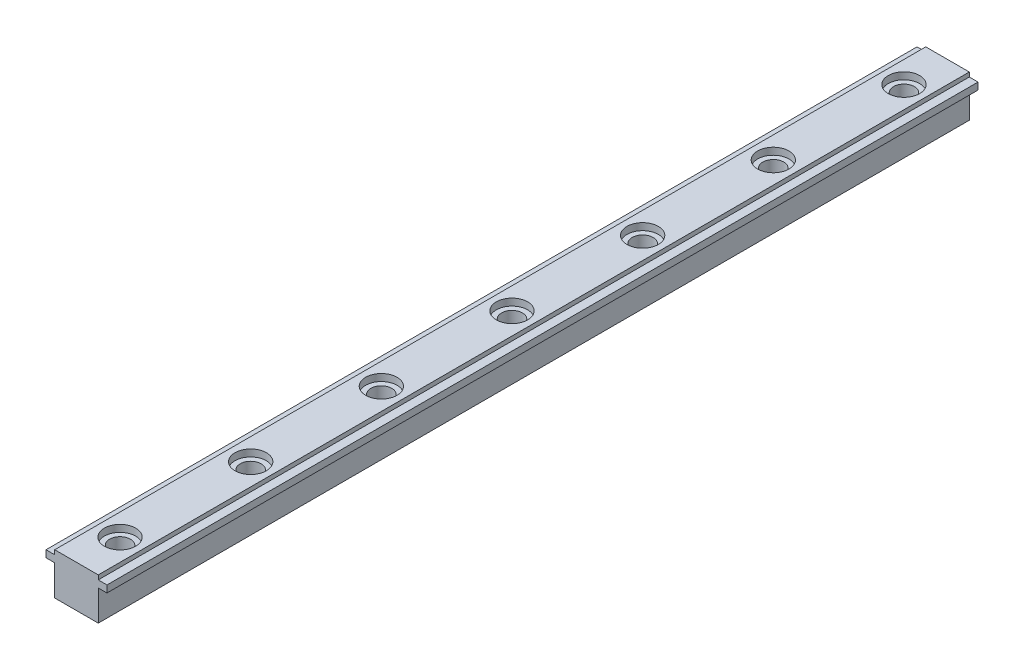
from build123d import *

# Parameters (mm, degrees)
SKETCH_1_W             = 1
SKETCH_1_H             = 0.8
EXTRUDE_1_DEPTH        = 40
CUT_EXTRUDE_1_DEPTH    = 55
SKETCH_3_R             = 1.8
CUT_EXTRUDE_2_DEPTH    = 0.8
MOVE_FACE_2_BY         = 60
PATTERN_LINEAR_1_COUNT = 5
PATTERN_LINEAR_1_PITCH = 15


with BuildPart() as part:
    # 草图1 → 凸台-拉伸1 (new body)
    with BuildSketch(Plane.XY):
        with Locations((-3.159883721, 0.568023256)):
            Rectangle(SKETCH_1_W, SKETCH_1_H)
        Polygon((-0.159883721, -3.331976744), (-0.159883721, 1.468023256), (-2.659883721, 1.468023256), (-2.659883721, 0.968023256), (-2.659883721, 0.168023256), (-2.659883721, -3.331976744), align=None)
        Polygon((2.340116279, 0.968023256), (2.340116279, 1.468023256), (-0.159883721, 1.468023256), (-0.159883721, -3.331976744), (2.340116279, -3.331976744), (2.340116279, 0.168023256), align=None)
        with Locations((2.840116279, 0.568023256)):
            Rectangle(SKETCH_1_W, SKETCH_1_H)
    extrude(amount=EXTRUDE_1_DEPTH)

    # 草图2 → 切除-拉伸1 (cut)
    with BuildSketch(Plane(origin=(0, 1.468023256, 0), x_dir=(1, 0, 0), z_dir=(0, 1, 0))):
        with BuildLine():
            ThreePointArc((-0.159883721, -3.8), (-1.359883721, -5), (-0.159883721, -6.2))
            Line((-0.159883721, -6.2), (-0.159883721, -3.8))
        make_face()
        with BuildLine():
            Line((-0.159883721, -3.8), (-0.159883721, -6.2))
            ThreePointArc((-0.159883721, -6.2), (0.688644416, -5.848528137), (1.040116279, -5))
            ThreePointArc((1.040116279, -5), (0.688644416, -4.151471863), (-0.159883721, -3.8))
        make_face()
        with BuildLine():
            ThreePointArc((-1.359883721, -20), (-1.008411858, -20.848528137), (-0.159883721, -21.2))
            Line((-0.159883721, -21.2), (-0.159883721, -20))
            Line((-0.159883721, -20), (-1.359883721, -20))
        make_face()
        with BuildLine():
            Line((-0.159883721, -20), (-0.159883721, -21.2))
            ThreePointArc((-0.159883721, -21.2), (0.688644416, -20.848528137), (1.040116279, -20))
            Line((1.040116279, -20), (-0.159883721, -20))
        make_face()
        with BuildLine():
            Line((-1.359883721, -20), (-0.159883721, -20))
            Line((-0.159883721, -20), (-0.159883721, -18.8))
            ThreePointArc((-0.159883721, -18.8), (-1.008411858, -19.151471863), (-1.359883721, -20))
        make_face()
        with BuildLine():
            Line((-0.159883721, -18.8), (-0.159883721, -20))
            Line((-0.159883721, -20), (1.040116279, -20))
            ThreePointArc((1.040116279, -20), (0.688644416, -19.151471863), (-0.159883721, -18.8))
        make_face()
        with BuildLine():
            ThreePointArc((-0.159883721, -33.8), (-1.359883721, -35), (-0.159883721, -36.2))
            Line((-0.159883721, -36.2), (-0.159883721, -35))
            Line((-0.159883721, -35), (-0.159883721, -33.8))
        make_face()
        with BuildLine():
            Line((-0.159883721, -35), (-0.159883721, -36.2))
            ThreePointArc((-0.159883721, -36.2), (0.688644416, -35.848528137), (1.040116279, -35))
            ThreePointArc((1.040116279, -35), (0.688644416, -34.151471863), (-0.159883721, -33.8))
            Line((-0.159883721, -33.8), (-0.159883721, -35))
        make_face()
    cut_extrude_1 = extrude(amount=-CUT_EXTRUDE_1_DEPTH, mode=Mode.SUBTRACT)

    # 草图3 → 切除-拉伸2 (cut)
    with BuildSketch(Plane(origin=(0, 1.468023256, 0), x_dir=(1, 0, 0), z_dir=(0, 1, 0))):
        with Locations(Location((-0.159883721, -35, 0), (0, 0, 270))):
            Circle(SKETCH_3_R)
        with Locations(Location((-0.159883721, -20, 0), (0, 0, 270))):
            Circle(SKETCH_3_R)
        with Locations(Location((-0.159883721, -5, 0), (0, 0, 270))):
            Circle(SKETCH_3_R)
    cut_extrude_2 = extrude(amount=-CUT_EXTRUDE_2_DEPTH, mode=Mode.SUBTRACT)

    # Move Face 2: a face moved outward by 60.0
    extrude(part.faces().sort_by_distance((-0.159883721, -0.838226744, 40))[0], amount=MOVE_FACE_2_BY, dir=(0, 0, 1))

    # 阵列(线性)1: 切除-拉伸1, 切除-拉伸2 ×5
    with Locations(*[(0, 0, i * PATTERN_LINEAR_1_PITCH) for i in range(1, PATTERN_LINEAR_1_COUNT)]):
        add(cut_extrude_1, mode=Mode.SUBTRACT)
        add(cut_extrude_2, mode=Mode.SUBTRACT)


solid = part.part
